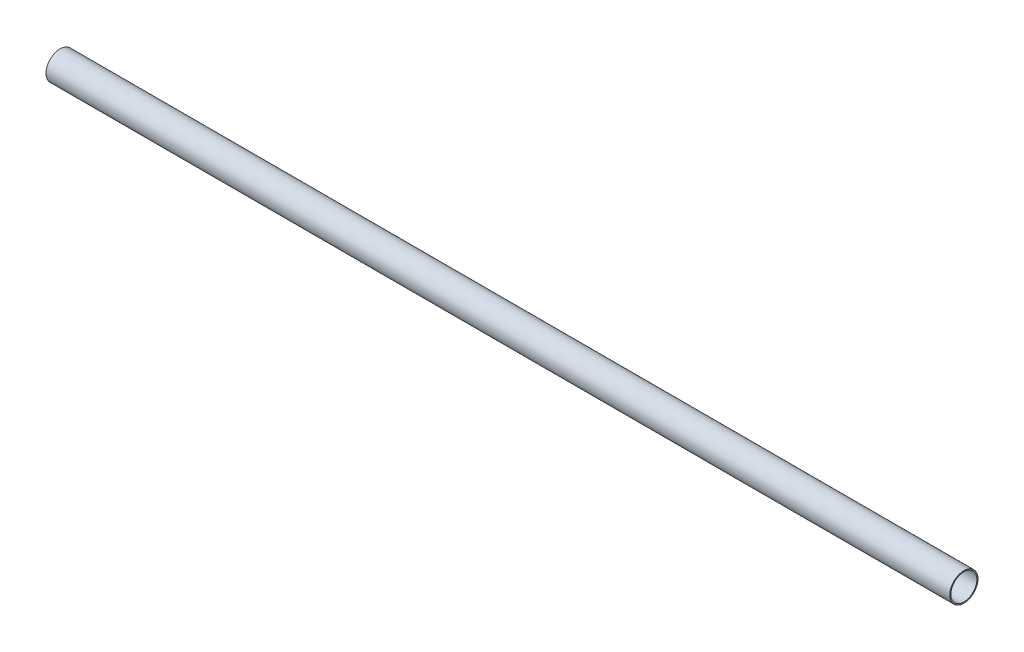
from build123d import *

# Parameters (mm, degrees)
SKETCH1_R          = 6.35
SKETCH1_R_2        = 5.842
EXTRUDE1_DEPTH     = 457.2
SKETCH5_R          = 6.35
SKETCH5_R_2        = 5.842
CUT_EXTRUDE1_DEPTH = 508


with BuildPart() as part:
    # Sketch1 → Extrude1 (new, symmetric)
    with BuildSketch(Plane(origin=(0, 0, 0), x_dir=(0, 0, -1), z_dir=(1, 0, 0))):
        Circle(SKETCH1_R)
        Circle(SKETCH1_R_2, mode=Mode.SUBTRACT)
    extrude(amount=EXTRUDE1_DEPTH, both=True)

    # Sketch5 → Cut-Extrude1 (cut)
    with BuildSketch(Plane.ZY.offset(457.2)):
        with Locations(Location((0, 0, 0), (0, 0, 180))):
            Circle(SKETCH5_R)
        with Locations(Location((0, 0, 0), (0, 0, 180))):
            Circle(SKETCH5_R_2, mode=Mode.SUBTRACT)
    extrude(amount=-CUT_EXTRUDE1_DEPTH, mode=Mode.SUBTRACT)


solid = part.part
